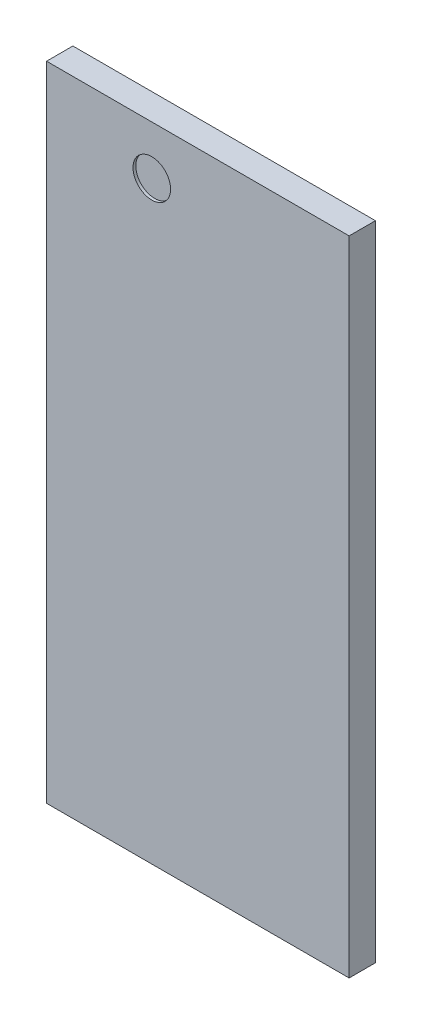
from build123d import *

# Parameters (mm, degrees)
SKETCH_1_W          = 161
SKETCH_1_H          = 342
EXTRUDE_1_DEPTH     = 14
SKETCH_1_3_R        = 10
CUT_EXTRUDE_1_DEPTH = 1.5


with BuildPart() as part:
    # 草图1 → 凸台-拉伸1 (new body)
    with BuildSketch(Plane.XY):
        Rectangle(SKETCH_1_W, SKETCH_1_H)
    extrude(amount=-EXTRUDE_1_DEPTH)

    # 草图1<3> → 切除-拉伸1 (cut)
    with BuildSketch(Plane.XY):
        with Locations((-24.5, 145)):
            Circle(SKETCH_1_3_R)
    extrude(amount=-CUT_EXTRUDE_1_DEPTH, mode=Mode.SUBTRACT)


solid = part.part
